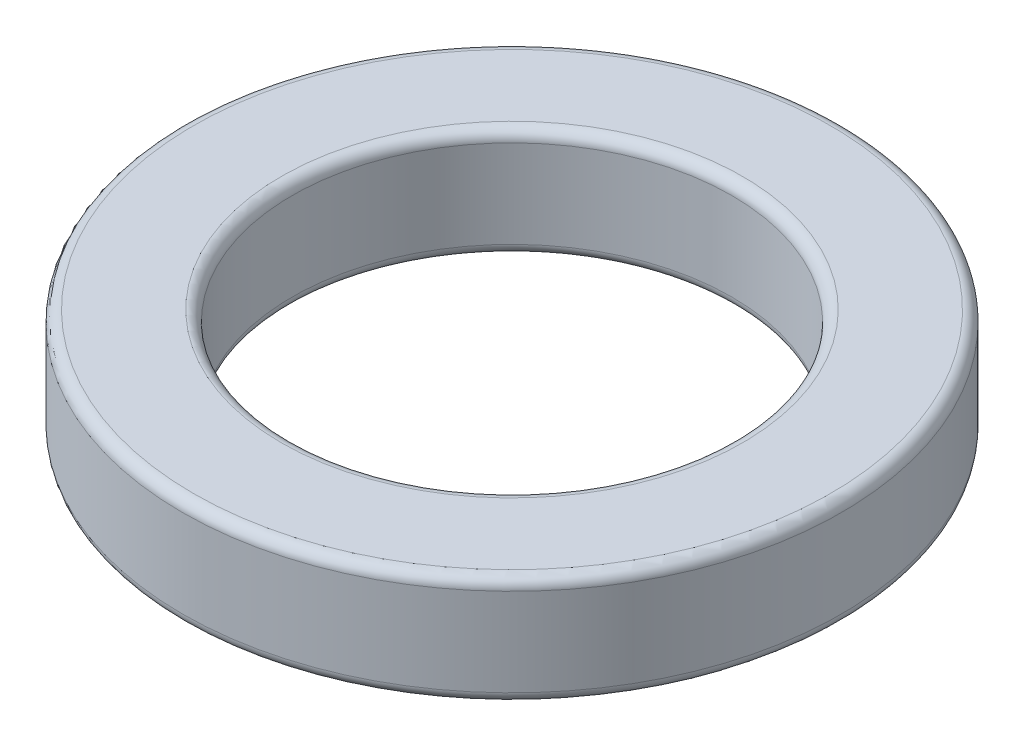
from build123d import *

# Parameters (mm, degrees)
SKETCH1_R           = 3
SKETCH1_R_2         = 2
BOSS_EXTRUDE1_DEPTH = 1
FILLET1_R           = 0.1


with BuildPart() as part:
    # Sketch1 → Boss-Extrude1 (new body)
    with BuildSketch(Plane(origin=(0, 0, 0), x_dir=(1, 0, 0), z_dir=(0, 1, 0))):
        with Locations(Location((0, 0, 0), (0, 0, 270))):
            Circle(SKETCH1_R)
        with Locations(Location((0, 0, 0), (0, 0, 270))):
            Circle(SKETCH1_R_2, mode=Mode.SUBTRACT)
    extrude(amount=BOSS_EXTRUDE1_DEPTH)

    # Fillet1
    fillet1_edges = [part.edges().sort_by_distance(p)[0] for p in [
        (0, 0, -3),
        (0, 1, -3),
        (0, 0, -2),
        (0, 1, -2),
    ]]
    fillet(fillet1_edges, radius=FILLET1_R)


solid = part.part
